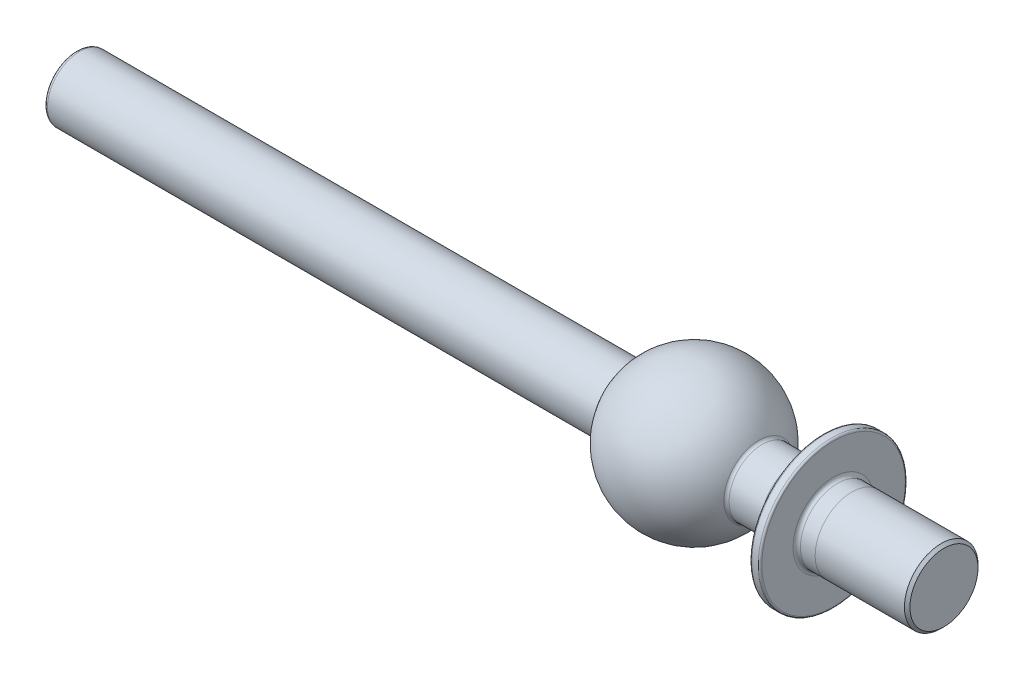
from build123d import *

# Parameters (mm, degrees)
CHAMFER1_SIZE       = 0.075
FILLET1_R           = 0.1
FILLET2_R           = 0.05
SKETCH3_R           = 0.875
BOSS_EXTRUDE1_DEPTH = 15
FILLET3_R           = 0.1


with BuildPart() as part:
    # Sketch1 → Revolve1 (revolve)
    with BuildSketch(Plane.XY, mode=Mode.PRIVATE) as revolve1_sk:
        with BuildLine():
            Line((0, 0), (0, 1))
            Line((0, 1), (-3, 1))
            Line((-3, 1), (-3, 2))
            Line((-3, 2), (-3.25, 2))
            Line((-3.25, 2), (-4, 0.9))
            Line((-4, 0.9), (-5, 0.9))
            ThreePointArc((-5, 0.9), (-6.800005741, 1.999951358), (-8.584493931, 0.875))
            Line((-8.584493931, 0.875), (-8.584493931, 0))
            Line((-8.584493931, 0), (-5, 0))
            Line((-5, 0), (0, 0))
        make_face()
    revolve(revolve1_sk.sketch.rotate(Axis((0, 0, 0), (-1, 0, 0)), 90), axis=Axis((0, 0, 0), (-1, 0, 0)))

    # Chamfer1
    chamfer1_edges = [part.edges().sort_by_distance(p)[0] for p in [
        (0, 0, 1),
    ]]
    chamfer(chamfer1_edges, length=CHAMFER1_SIZE)

    # Fillet1
    fillet1_edges = [part.edges().sort_by_distance(p)[0] for p in [
        (-4, 0, 0.9),
        (-5, 0, 0.9),
        (-3, 0, 1),
    ]]
    fillet(fillet1_edges, radius=FILLET1_R)

    # Fillet2
    fillet2_edges = [part.edges().sort_by_distance(p)[0] for p in [
        (-3, 0, 2),
        (-3.25, 0, 2),
    ]]
    fillet(fillet2_edges, radius=FILLET2_R)

    # Sketch3 → Boss-Extrude1 (add)
    with BuildSketch(Plane.ZY.offset(8.584493931)):
        with Locations(Location((0, 0, 0), (0, 0, 90))):
            Circle(SKETCH3_R)
    extrude(amount=BOSS_EXTRUDE1_DEPTH)

    # Fillet3
    fillet3_edges = [part.edges().sort_by_distance(p)[0] for p in [
        (-23.584493931, -0.875, 0),
    ]]
    fillet(fillet3_edges, radius=FILLET3_R)


solid = part.part
